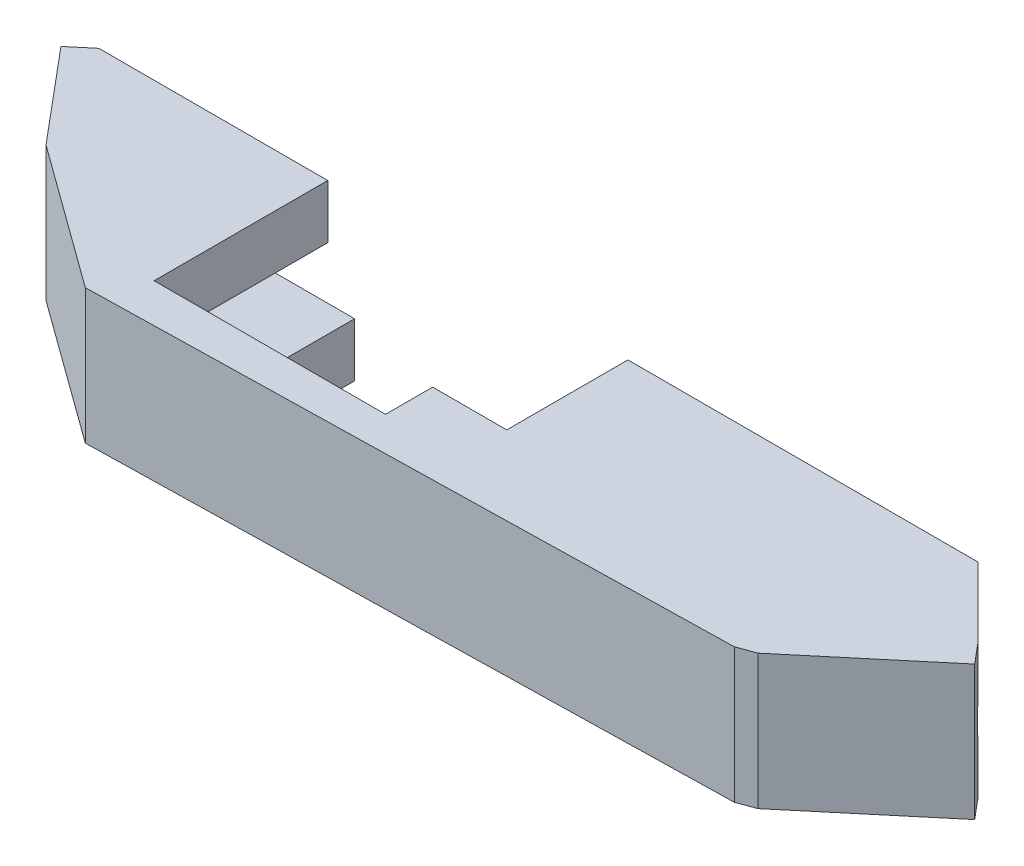
from build123d import *

# Parameters (mm, degrees)
SKETCH1_W                = 0.3
SKETCH1_H                = 0.3
BOSS_EXTRUDE1_DEPTH      = 4
SKETCH1_5_W              = 0.3
SKETCH1_5_H              = 0.3
BOSS_EXTRUDE2_DEPTH      = 4
BOSS_EXTRUDE3_DEPTH      = 3
BOSS_EXTRUDE4_DEPTH      = 3.00199999
BOSS_EXTRUDE4_DEPTH_BACK = 0.99800001
SKETCH3_W                = 4.5
SKETCH3_H                = 3.5
CUT_EXTRUDE1_DEPTH       = 4


with BuildPart() as part:
    # Sketch1 → Boss-Extrude1 (new body)
    with BuildSketch(Plane(origin=(0, 0, 0), x_dir=(1, 0, 0), z_dir=(0, 1, 0))):
        Polygon((2.114911513, 12.894399988), (-14.885088487, 12.894399988), (-16.417177373, 11.608824769), (-10.632088886, 4.714424781), (0, -3), (47.2, -2), (48.485575219, -1.532088886), (57.239858961, 5.813627372), (55.954283741, 7.345716259), (50.8, 12.5), (24.8, 12.5), (24.8, 3.5), (14.8, 3.5), (14.8, 0), (2.114911513, 0), align=None)
        with Locations((-0.15, -0.15)):
            Rectangle(SKETCH1_W, SKETCH1_H, mode=Mode.SUBTRACT)
        Polygon((47.30919107, -0.3), (47.2, -0.3), (47.2, 0), (47.392836283, -0.229813333), align=None, mode=Mode.SUBTRACT)
    extrude(amount=BOSS_EXTRUDE1_DEPTH)

    # Sketch1<5> → Boss-Extrude2 (add)
    with BuildSketch(Plane(origin=(0, 0, 0), x_dir=(1, 0, 0), z_dir=(0, 1, 0))):
        with Locations((-0.15, -0.15)):
            Rectangle(SKETCH1_5_W, SKETCH1_5_H)
        Polygon((47.2, 0), (47.2, -0.3), (47.30919107, -0.3), (47.392836283, -0.229813333), align=None)
    extrude(amount=BOSS_EXTRUDE2_DEPTH)

    # Sketch1<6> → Boss-Extrude3 (add)
    with BuildSketch(Plane(origin=(0, 0, 0), x_dir=(1, 0, 0), z_dir=(0, 1, 0))):
        with BuildLine():
            Line((-0.3, -0.3), (-0.3, 4.117528082))
            ThreePointArc((-0.3, 4.117528082), (-0.885786438, 5.114213562), (-1.882471918, 5.7))
            Line((-1.882471918, 5.7), (-9.239892297, 5.7))
            Line((-9.239892297, 5.7), (-15.11490182, 12.701563705))
            Line((-15.11490182, 12.701563705), (-16.417177373, 11.608824769))
            Line((-16.417177373, 11.608824769), (-10.632088886, 4.714424781))
            Line((-10.632088886, 4.714424781), (0, -3))
            Line((0, -3), (47.2, -2))
            Line((47.2, -2), (48.485575219, -1.532088886))
            Line((48.485575219, -1.532088886), (57.239858961, 5.813627372))
            Line((57.239858961, 5.813627372), (56.147120024, 7.115902926))
            Line((56.147120024, 7.115902926), (47.30919107, -0.3))
            Line((47.30919107, -0.3), (38.858723672, -0.3))
            Line((38.858723672, -0.3), (38.858723672, 0.607136774))
            ThreePointArc((38.858723672, 0.607136774), (33.95, 4.199275448), (29.041276328, 0.607136774))
            Line((29.041276328, 0.607136774), (29.041276328, -0.3))
            Line((29.041276328, -0.3), (-0.3, -0.3))
        make_face()
    extrude(amount=-BOSS_EXTRUDE3_DEPTH)

    # Sketch2 → Boss-Extrude4 (add, two sides: drawn at the far end of the back side and taken through both)
    with BuildSketch(Plane(origin=(0, -3, 0), x_dir=(-1, 0, 0), z_dir=(0, -1, 0)).offset(-BOSS_EXTRUDE4_DEPTH_BACK)):
        Polygon((-55.954283741, 7.345716259), (-57.239858961, 5.813627372), (-48.485575219, -1.532088886), (-47.2, -2), (0, -3), (10.632088886, 4.714424781), (16.417177373, 11.608824769), (14.885088487, 12.894399988), (13.295498156, 11), (-6, 11), (-6, 5.000587023), (-21.8, 5.000587023), (-21.8, 11), (-51.796266659, 11), (-51.796266659, 3.856725658), align=None)
    extrude(amount=BOSS_EXTRUDE4_DEPTH + BOSS_EXTRUDE4_DEPTH_BACK)

    # Sketch3 → Cut-Extrude1 (cut)
    with BuildSketch(Plane(origin=(0, 4, 0), x_dir=(1, 0, 0), z_dir=(0, 1, 0))):
        with Locations((17.05, 1.75)):
            Rectangle(SKETCH3_W, SKETCH3_H)
    extrude(amount=-CUT_EXTRUDE1_DEPTH, mode=Mode.SUBTRACT)


solid = part.part
